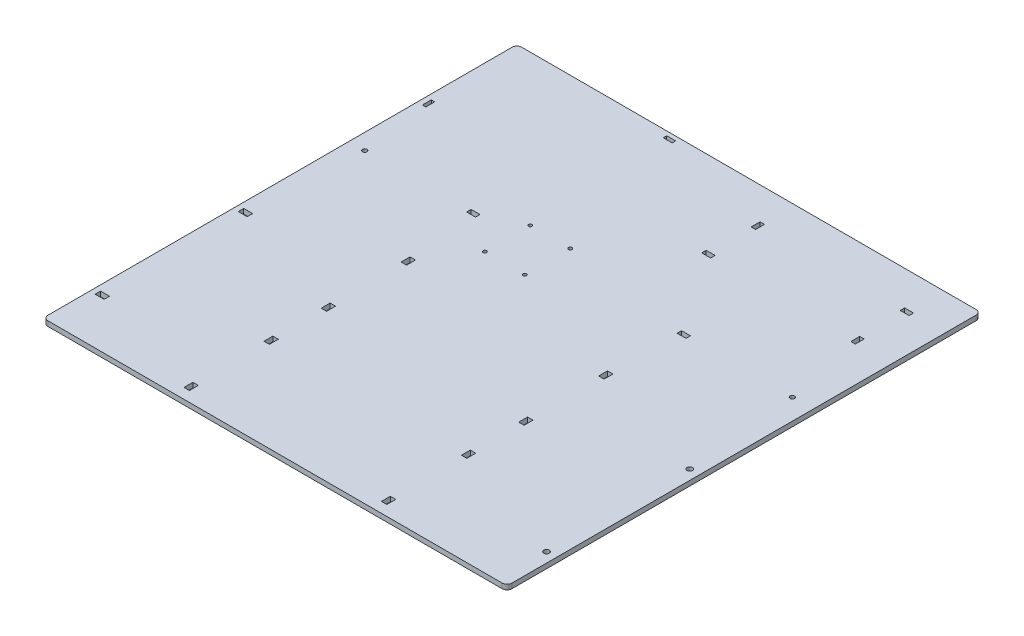
from build123d import *

# Parameters (mm, degrees)
SKETCH_1_W          = 470
SKETCH_1_H          = 480
EXTRUDE_1_DEPTH     = 5
FILLET_1_R          = 5
SKETCH_2_R          = 2.25
SKETCH_2_R_2        = 1.75
SKETCH_2_R_3        = 2.75
CUT_EXTRUDE_1_DEPTH = 336.931540645
SKETCH_3_W          = 9
SKETCH_3_H          = 4.5
SKETCH_3_W_2        = 4.5
SKETCH_3_H_2        = 9
SKETCH_3_H_3        = 3.5
SKETCH_3_W_3        = 3.5
SKETCH_3_W_4        = 5.5
SKETCH_3_H_4        = 5.5
CUT_EXTRUDE_2_DEPTH = 336.931540645


with BuildPart() as part:
    # 草图1 → 凸台-拉伸1 (new body)
    with BuildSketch(Plane(origin=(0, 0, 0), x_dir=(1, 0, 0), z_dir=(0, 1, 0))):
        Rectangle(SKETCH_1_W, SKETCH_1_H)
    extrude(amount=EXTRUDE_1_DEPTH)

    # 圆角1
    fillet_1_edges = [part.edges().sort_by_distance(p)[0] for p in [
        (235, 2.5, 240),
        (-235, 2.5, 240),
        (-235, 2.5, -240),
        (235, 2.5, -240),
    ]]
    fillet(fillet_1_edges, radius=FILLET_1_R)

    # 草图2 → 切除-拉伸1 (cut, through all)
    with BuildSketch(Plane(origin=(0, 5, 0), x_dir=(1, 0, 0), z_dir=(0, 1, 0))):
        with Locations(Location((197, 153, 0), (0, 0, 270))):
            Circle(SKETCH_2_R)
        with Locations(Location((46, 153, 0), (0, 0, 270))):
            Circle(SKETCH_2_R)
        with Locations(Location((197, 203, 0), (0, 0, 270))):
            Circle(SKETCH_2_R)
        with Locations(Location((46, 203, 0), (0, 0, 270))):
            Circle(SKETCH_2_R)
        with Locations(Location((-228, 143.5, 0), (0, 0, 270))):
            Circle(SKETCH_2_R_2)
        with Locations(Location((-74.5, 234, 0), (0, 0, 270))):
            Circle(SKETCH_2_R_2)
        with Locations(Location((-219, 69.8, 0), (0, 0, 270))):
            Circle(SKETCH_2_R)
        with Locations(Location((-109, 69.8, 0), (0, 0, 270))):
            Circle(SKETCH_2_R)
        with Locations(Location((-69.5, 42, 0), (0, 0, 270))):
            Circle(SKETCH_2_R_2)
        with Locations(Location((-69.5, 88, 0), (0, 0, 270))):
            Circle(SKETCH_2_R_2)
        with Locations(Location((-29, 42, 0), (0, 0, 270))):
            Circle(SKETCH_2_R_2)
        with Locations(Location((-29, 88, 0), (0, 0, 270))):
            Circle(SKETCH_2_R_2)
        with Locations(Location((214, 70, 0), (0, 0, 270))):
            Circle(SKETCH_2_R)
        with Locations(Location((104, 70, 0), (0, 0, 270))):
            Circle(SKETCH_2_R)
        with Locations(Location((225, -190, 0), (0, 0, 270))):
            Circle(SKETCH_2_R_3)
        with Locations(Location((225, -45, 0), (0, 0, 270))):
            Circle(SKETCH_2_R_3)
        with Locations(Location((100, -5, 0), (0, 0, 270))):
            Circle(SKETCH_2_R_3)
        with Locations(Location((100, -225, 0), (0, 0, 270))):
            Circle(SKETCH_2_R_3)
        with Locations(Location((100, -144, 0), (0, 0, 270))):
            Circle(SKETCH_2_R_3)
        with Locations(Location((100, -86, 0), (0, 0, 270))):
            Circle(SKETCH_2_R_3)
        with Locations(Location((-100, -5, 0), (0, 0, 90))):
            Circle(SKETCH_2_R_3)
        with Locations(Location((-100, -86, 0), (0, 0, 90))):
            Circle(SKETCH_2_R_3)
        with Locations(Location((-100, -144, 0), (0, 0, 90))):
            Circle(SKETCH_2_R_3)
        with Locations(Location((-100, -225, 0), (0, 0, 90))):
            Circle(SKETCH_2_R_3)
        with Locations(Location((-225, -45, 0), (0, 0, 90))):
            Circle(SKETCH_2_R_3)
        with Locations(Location((-225, -190, 0), (0, 0, 90))):
            Circle(SKETCH_2_R_3)
    extrude(amount=-CUT_EXTRUDE_1_DEPTH, mode=Mode.SUBTRACT)

    # 草图3 → 切除-拉伸2 (cut, through all)
    with BuildSketch(Plane(origin=(0, 5, 0), x_dir=(1, 0, 0), z_dir=(0, 1, 0))):
        with Locations((104, 70)):
            Rectangle(SKETCH_3_W, SKETCH_3_H)
        with Locations((-109, 69.8)):
            Rectangle(SKETCH_3_W, SKETCH_3_H)
        with Locations((197, 153)):
            Rectangle(SKETCH_3_W_2, SKETCH_3_H_2)
        with Locations((-74.5, 234)):
            Rectangle(SKETCH_3_W, SKETCH_3_H_3)
        with Locations((-228, 143.5)):
            Rectangle(SKETCH_3_W_3, SKETCH_3_H_2)
        with Locations((197, 203)):
            Rectangle(SKETCH_3_W, SKETCH_3_H)
        with Locations((46, 203)):
            Rectangle(SKETCH_3_W_2, SKETCH_3_H_2)
        with Locations((46, 153)):
            Rectangle(SKETCH_3_W, SKETCH_3_H)
        with Locations((100, -225)):
            Rectangle(SKETCH_3_W_4, SKETCH_3_H_2)
        with Locations((100, -144)):
            Rectangle(SKETCH_3_W_4, SKETCH_3_H_2)
        with Locations((100, -86)):
            Rectangle(SKETCH_3_W_4, SKETCH_3_H_2)
        with Locations((100, -5)):
            Rectangle(SKETCH_3_W_4, SKETCH_3_H_2)
        with Locations((-225, -190)):
            Rectangle(SKETCH_3_W, SKETCH_3_H_4)
        with Locations((-225, -45)):
            Rectangle(SKETCH_3_W, SKETCH_3_H_4)
        with Locations((-100, -5)):
            Rectangle(SKETCH_3_W_4, SKETCH_3_H_2)
        with Locations((-100, -86)):
            Rectangle(SKETCH_3_W_4, SKETCH_3_H_2)
        with Locations((-100, -144)):
            Rectangle(SKETCH_3_W_4, SKETCH_3_H_2)
        with Locations((-100, -225)):
            Rectangle(SKETCH_3_W_4, SKETCH_3_H_2)
    extrude(amount=-CUT_EXTRUDE_2_DEPTH, mode=Mode.SUBTRACT)


solid = part.part
